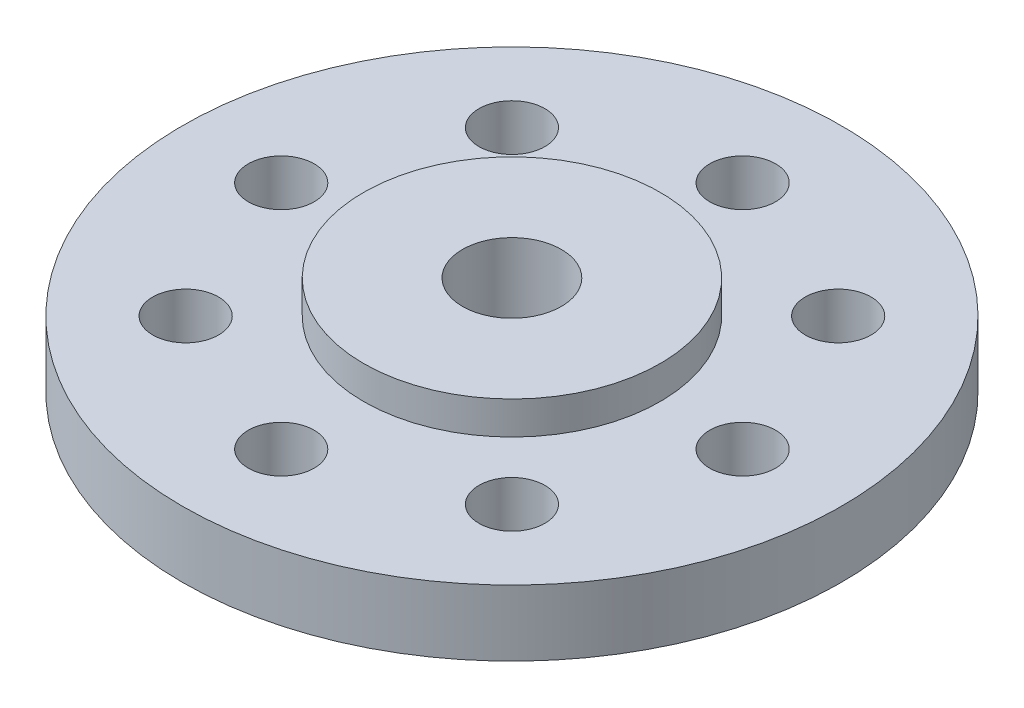
from build123d import *

# Parameters (mm, degrees)
SKETCH_1_R          = 4.5
EXTRUDE_1_DEPTH     = 1
EXTRUDE_START       = 1
SKETCH_1_3_R        = 10
EXTRUDE_2_DEPTH     = 2
EXTRUDE_START_2     = 3
SKETCH_1_4_R        = 4.5
EXTRUDE_3_DEPTH     = 1
SKETCH_2_R          = 1.5
SKETCH_2_R_2        = 1
CUT_EXTRUDE_1_DEPTH = 15.696938457


with BuildPart() as part:
    # Эскиз1 → Бобышка-Вытянуть1 (new body)
    with BuildSketch(Plane(origin=(0, 0, 0), x_dir=(1, 0, 0), z_dir=(0, 1, 0))):
        Circle(SKETCH_1_R)
    extrude(amount=EXTRUDE_1_DEPTH)


with BuildPart() as body_2:
    # Эскиз1<3> → Бобышка-Вытянуть2 (new body)
    with BuildSketch(Plane(origin=(0, 0, 0), x_dir=(1, 0, 0), z_dir=(0, 1, 0)).offset(EXTRUDE_START)):
        Circle(SKETCH_1_3_R)
    extrude(amount=EXTRUDE_2_DEPTH)

    # Эскиз1<4> → Бобышка-Вытянуть3 (add)
    with BuildSketch(Plane(origin=(0, 0, 0), x_dir=(1, 0, 0), z_dir=(0, 1, 0)).offset(EXTRUDE_START_2)):
        Circle(SKETCH_1_4_R)
    extrude(amount=EXTRUDE_3_DEPTH)


with BuildPart() as cut_extrude_1_tool:
    # Эскиз2 → Вырез-Вытянуть1 (new, through all)
    with BuildSketch(Plane(origin=(0, 0, 0), x_dir=(1, 0, 0), z_dir=(0, 1, 0))):
        Circle(SKETCH_2_R)
        with Locations((-7, 0)):
            Circle(SKETCH_2_R_2)
        with Locations((-4.949747468, 4.949747468)):
            Circle(SKETCH_2_R_2)
        with Locations((0, 7)):
            Circle(SKETCH_2_R_2)
        with Locations((4.949747468, 4.949747468)):
            Circle(SKETCH_2_R_2)
        with Locations((7, 0)):
            Circle(SKETCH_2_R_2)
        with Locations((4.949747468, -4.949747468)):
            Circle(SKETCH_2_R_2)
        with Locations((0, -7)):
            Circle(SKETCH_2_R_2)
        with Locations((-4.949747468, -4.949747468)):
            Circle(SKETCH_2_R_2)
    extrude(amount=CUT_EXTRUDE_1_DEPTH)


with BuildPart() as part_1:
    add(part.part)

    # Вырез-Вытянуть1: cut by cut_extrude_1_tool
    add(cut_extrude_1_tool.part, mode=Mode.SUBTRACT)


with BuildPart() as body_2_1:
    add(body_2.part)

    # Вырез-Вытянуть1: cut by cut_extrude_1_tool
    add(cut_extrude_1_tool.part, mode=Mode.SUBTRACT)


solid = Compound([part_1.part, body_2_1.part])
